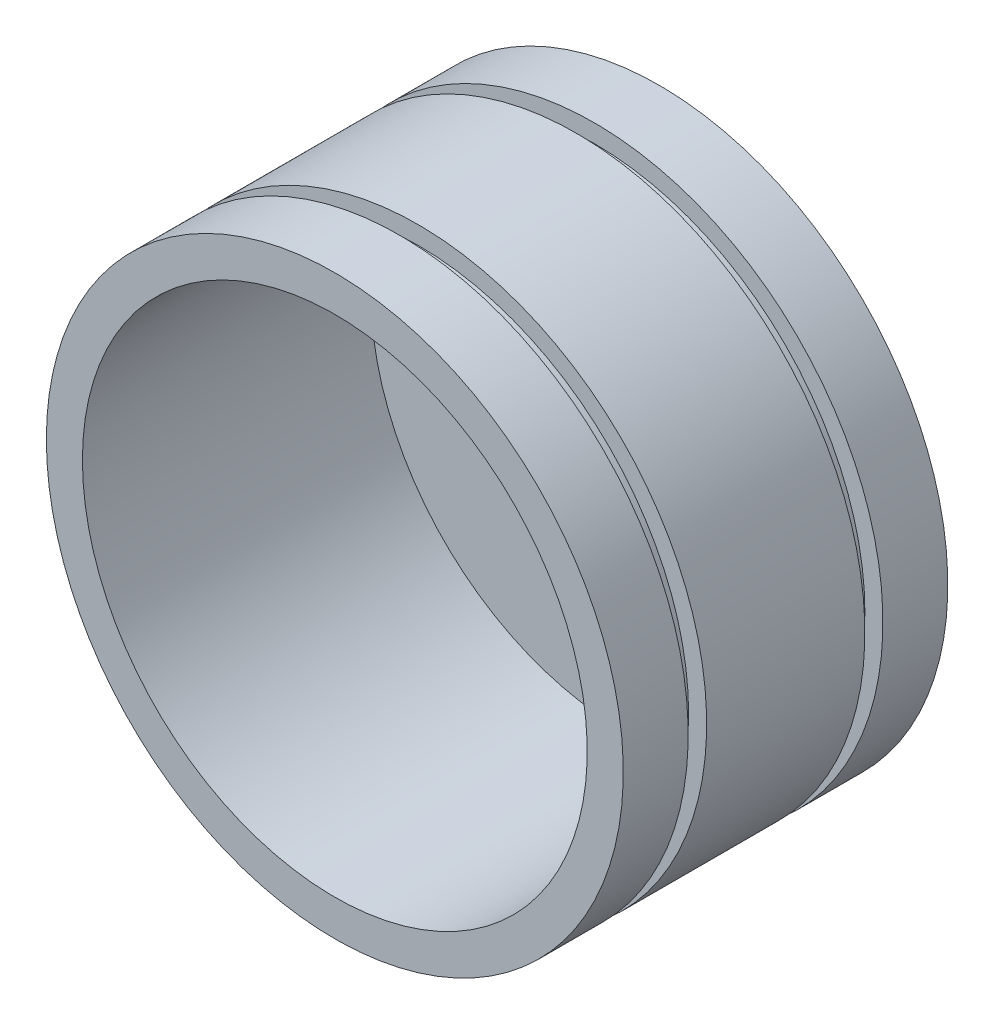
from build123d import *

# Parameters (mm, degrees)
SKETCH3_R          = 3.81
CUT_EXTRUDE1_DEPTH = 107.706198127


with BuildPart() as part:
    # Sketch2 → Revolve1 (revolve)
    with BuildSketch(Plane(origin=(0, 0, 0), x_dir=(1, 0, 0), z_dir=(0, 1, 0))):
        Polygon((-16.351757188, 17.29715655), (-22.701757188, 17.29715655), (-22.701757188, 28.72715655), (-19.526757188, 28.72715655), (-19.526757188, 31.97835655), (-22.701757188, 31.97835655), (-22.701757188, 59.84215655), (-19.526757188, 59.84215655), (-19.526757188, 63.01715655), (-22.701757188, 63.01715655), (-22.701757188, 74.44715655), (28.098242812, 74.44715655), (28.098242812, 68.09715655), (-16.351757188, 68.09715655), align=None)
    revolve(axis=Axis((28.098242812, 0, -74.44715655), (0, 0, 1)))

    # Sketch3 → Cut-Extrude1 (cut, through all)
    with BuildSketch(Plane.XY.offset(-68.09715655)):
        with Locations((28.098242812, 0)):
            Circle(SKETCH3_R)
    extrude(amount=-CUT_EXTRUDE1_DEPTH, mode=Mode.SUBTRACT)


solid = part.part
